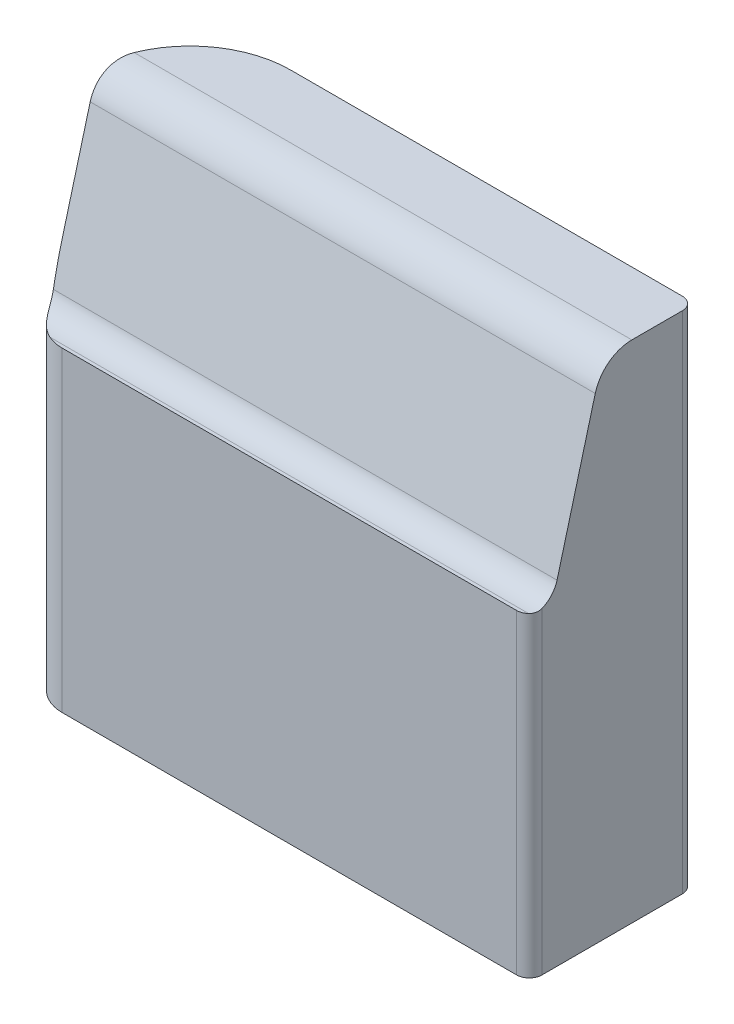
from build123d import *

# Parameters (mm, degrees)
BOSS_EXTRUDE1_DEPTH         = 20
FILLET1_R                   = 1
FILLET2_R                   = 2
FILLET3_R                   = 8
FILLET4_R                   = 3
M6_TAPPED_HOLE1_D           = 5
M6_TAPPED_HOLE1_DEPTH       = 15
M6_TAPPED_HOLE1_CSINK_D     = 6.05
M6_TAPPED_HOLE1_CSINK_ANGLE = 90
M6_TAPPED_HOLE1_TIP         = 1.502151548


with BuildPart() as part:
    # Sketch1 → Boss-Extrude1 (new, symmetric)
    with BuildSketch(Plane(origin=(0, 0, 0), x_dir=(0, 0, -1), z_dir=(1, 0, 0))):
        with BuildLine():
            Line((-5, 0), (0, 0))
            Line((0, 0), (0, -40))
            Line((0, -40), (-13.12, -40))
            Line((-13.12, -40), (-13.12, -15))
            Line((-13.12, -15), (-11.32121885, -15))
            Line((-11.32121885, -15), (-7.897777479, -2.223542865))
            ThreePointArc((-7.897777479, -2.223542865), (-6.826284287, -0.619939979), (-5, 0))
        make_face()
    extrude(amount=BOSS_EXTRUDE1_DEPTH, both=True)

    # Fillet1
    fillet1_edges = [part.edges().sort_by_distance(p)[0] for p in [
        (20, -27.5, 13.12),
        (20, -20, 0),
    ]]
    fillet(fillet1_edges, radius=FILLET1_R)

    # Fillet2
    fillet2_edges = [part.edges().sort_by_distance(p)[0] for p in [
        (0, -15, 11.32121885),
    ]]
    fillet(fillet2_edges, radius=FILLET2_R)

    # Fillet3
    fillet3_edges = [part.edges().sort_by_distance(p)[0] for p in [
        (-20, -20, 0),
    ]]
    fillet(fillet3_edges, radius=FILLET3_R)

    # Fillet4
    fillet4_edges = [part.edges().sort_by_distance(p)[0] for p in [
        (-20, -27.5, 13.12),
    ]]
    fillet(fillet4_edges, radius=FILLET4_R)

    # M6 Tapped Hole1
    with Locations(Plane(origin=(0, -40, 0), x_dir=(-1, 0, 0), z_dir=(0, -1, 0))):
        with Locations((-13, -6.56), (9.869332882, -6.56)):
            CounterSinkHole(M6_TAPPED_HOLE1_D / 2, M6_TAPPED_HOLE1_CSINK_D / 2, depth=M6_TAPPED_HOLE1_DEPTH, counter_sink_angle=M6_TAPPED_HOLE1_CSINK_ANGLE)
            with Locations((0, 0, -(M6_TAPPED_HOLE1_DEPTH + M6_TAPPED_HOLE1_TIP / 2))):  # 118° drill point
                Cone(0, M6_TAPPED_HOLE1_D / 2, M6_TAPPED_HOLE1_TIP, mode=Mode.SUBTRACT)


solid = part.part
